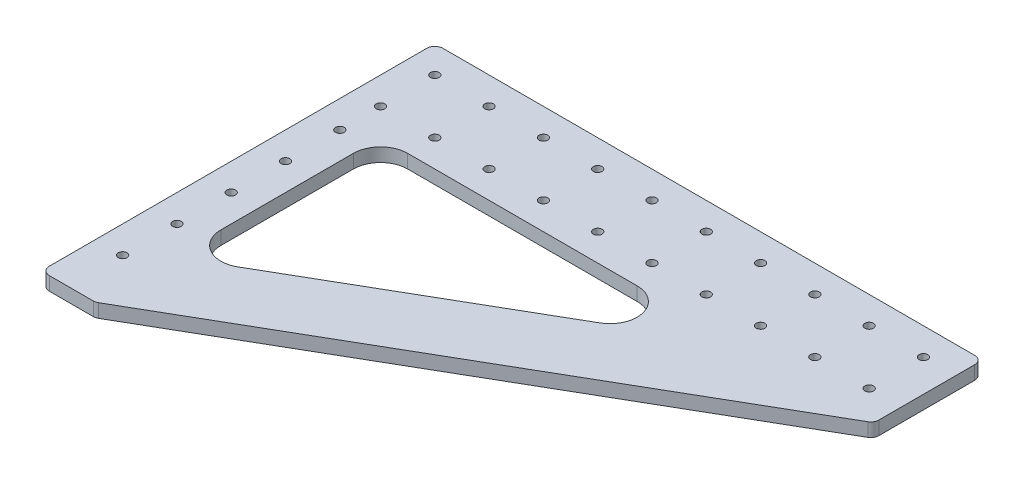
from build123d import *

# Parameters (mm, degrees)
SKETCH_1_R      = 1.6
EXTRUDE_1_DEPTH = 5
FILLET_1_R      = 10
FILLET_2_R      = 3


with BuildPart() as part:
    # 草图1 → 凸台-拉伸1 (new body)
    with BuildSketch(Plane(origin=(0, 0, 0), x_dir=(1, 0, 0), z_dir=(0, 1, 0))):
        Polygon((0, -105), (-20, -105), (-20, 40), (181.865334795, 40), (181.865334795, 0), align=None)
        with Locations(Location((-10, -5, 0), (0, 0, 270))):
            Circle(SKETCH_1_R, mode=Mode.SUBTRACT)
        with Locations(Location((-10, -25, 0), (0, 0, 270))):
            Circle(SKETCH_1_R, mode=Mode.SUBTRACT)
        with Locations(Location((-10, -45, 0), (0, 0, 270))):
            Circle(SKETCH_1_R, mode=Mode.SUBTRACT)
        with Locations(Location((-10, 10, 0), (0, 0, 270))):
            Circle(SKETCH_1_R, mode=Mode.SUBTRACT)
        with Locations(Location((-10, 30, 0), (0, 0, 270))):
            Circle(SKETCH_1_R, mode=Mode.SUBTRACT)
        with Locations(Location((10, 30, 0), (0, 0, 270))):
            Circle(SKETCH_1_R, mode=Mode.SUBTRACT)
        with Locations(Location((10, 10, 0), (0, 0, 270))):
            Circle(SKETCH_1_R, mode=Mode.SUBTRACT)
        with Locations(Location((30, 10, 0), (0, 0, 270))):
            Circle(SKETCH_1_R, mode=Mode.SUBTRACT)
        with Locations(Location((-10, -65, 0), (0, 0, 270))):
            Circle(SKETCH_1_R, mode=Mode.SUBTRACT)
        with Locations(Location((-10, -85, 0), (0, 0, 270))):
            Circle(SKETCH_1_R, mode=Mode.SUBTRACT)
        with Locations(Location((50, 10, 0), (0, 0, 270))):
            Circle(SKETCH_1_R, mode=Mode.SUBTRACT)
        with Locations(Location((70, 10, 0), (0, 0, 270))):
            Circle(SKETCH_1_R, mode=Mode.SUBTRACT)
        with Locations(Location((90, 10, 0), (0, 0, 270))):
            Circle(SKETCH_1_R, mode=Mode.SUBTRACT)
        with Locations(Location((110, 10, 0), (0, 0, 270))):
            Circle(SKETCH_1_R, mode=Mode.SUBTRACT)
        with Locations(Location((130, 10, 0), (0, 0, 270))):
            Circle(SKETCH_1_R, mode=Mode.SUBTRACT)
        with Locations(Location((150, 10, 0), (0, 0, 270))):
            Circle(SKETCH_1_R, mode=Mode.SUBTRACT)
        with Locations(Location((170, 10, 0), (0, 0, 270))):
            Circle(SKETCH_1_R, mode=Mode.SUBTRACT)
        with Locations(Location((50, 30, 0), (0, 0, 270))):
            Circle(SKETCH_1_R, mode=Mode.SUBTRACT)
        with Locations(Location((70, 30, 0), (0, 0, 270))):
            Circle(SKETCH_1_R, mode=Mode.SUBTRACT)
        with Locations(Location((90, 30, 0), (0, 0, 270))):
            Circle(SKETCH_1_R, mode=Mode.SUBTRACT)
        with Locations(Location((110, 30, 0), (0, 0, 270))):
            Circle(SKETCH_1_R, mode=Mode.SUBTRACT)
        with Locations(Location((130, 30, 0), (0, 0, 270))):
            Circle(SKETCH_1_R, mode=Mode.SUBTRACT)
        with Locations(Location((150, 30, 0), (0, 0, 270))):
            Circle(SKETCH_1_R, mode=Mode.SUBTRACT)
        with Locations(Location((170, 30, 0), (0, 0, 270))):
            Circle(SKETCH_1_R, mode=Mode.SUBTRACT)
        with Locations(Location((30, 30, 0), (0, 0, 270))):
            Circle(SKETCH_1_R, mode=Mode.SUBTRACT)
        Polygon((0, -76.132486541), (0, 0), (131.865334795, 0), align=None, mode=Mode.SUBTRACT)
    extrude(amount=EXTRUDE_1_DEPTH)

    # 圆角1
    fillet_1_edges = [part.edges().sort_by_distance(p)[0] for p in [
        (0, 2.5, 0),
        (0, 2.5, 76.132486541),
        (131.865334795, 2.5, 0),
    ]]
    fillet(fillet_1_edges, radius=FILLET_1_R)

    # 圆角2
    fillet_2_edges = [part.edges().sort_by_distance(p)[0] for p in [
        (-20, 2.5, 105),
        (-20, 2.5, -40),
        (181.865334795, 2.5, -40),
        (181.865334795, 2.5, 0),
        (0, 2.5, 105),
    ]]
    fillet(fillet_2_edges, radius=FILLET_2_R)


solid = part.part
